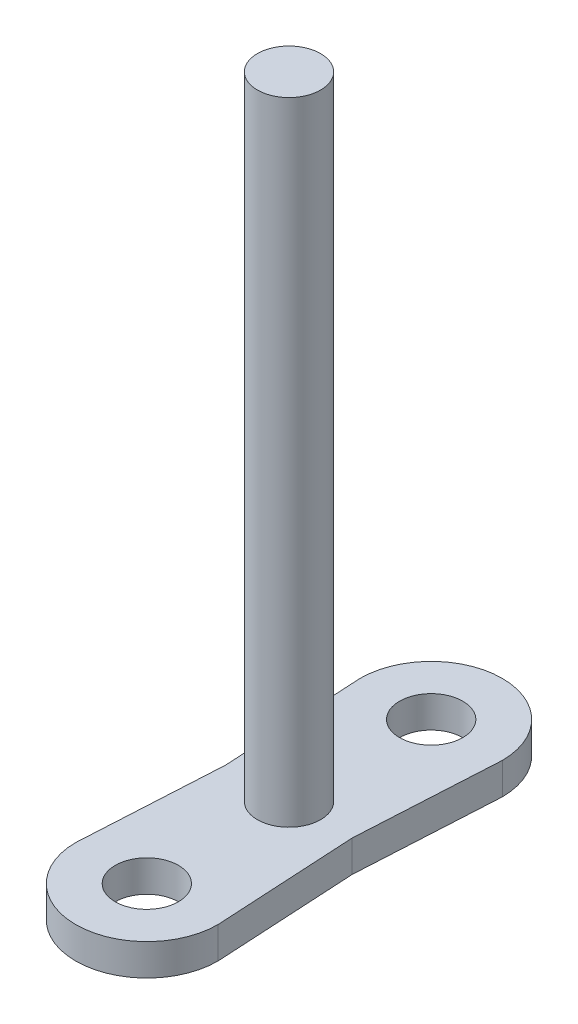
from build123d import *

# Parameters (mm, degrees)
SKETCH1_R           = 2
BOSS_EXTRUDE1_DEPTH = 40
SKETCH2_R           = 2
BOSS_EXTRUDE2_DEPTH = 2


with BuildPart() as part:
    # Sketch1 → Boss-Extrude1 (new body)
    with BuildSketch(Plane(origin=(0, 0, 0), x_dir=(1, 0, 0), z_dir=(0, 1, 0))):
        with Locations(Location((0, 0, 0), (0, 0, 270))):
            Circle(SKETCH1_R)
    extrude(amount=BOSS_EXTRUDE1_DEPTH)


with BuildPart() as body_2:
    # Sketch2 → Boss-Extrude2 (new body)
    with BuildSketch(Plane.XZ):
        with BuildLine():
            ThreePointArc((4.5, 9), (0, 13.5), (-4.5, 9))
            Line((-4.5, 9), (-4, 0))
            Line((-4, 0), (-4.5, -9))
            ThreePointArc((-4.5, -9), (0, -13.5), (4.5, -9))
            Line((4.5, -9), (4, 0))
            Line((4, 0), (4.5, 9))
        make_face()
        with Locations(Location((0, 9, 0), (0, 0, 270))):
            Circle(SKETCH2_R, mode=Mode.SUBTRACT)
        with Locations(Location((0, -9, 0), (0, 0, 270))):
            Circle(SKETCH2_R, mode=Mode.SUBTRACT)
    extrude(amount=BOSS_EXTRUDE2_DEPTH)


solid = Compound([part.part, body_2.part])
